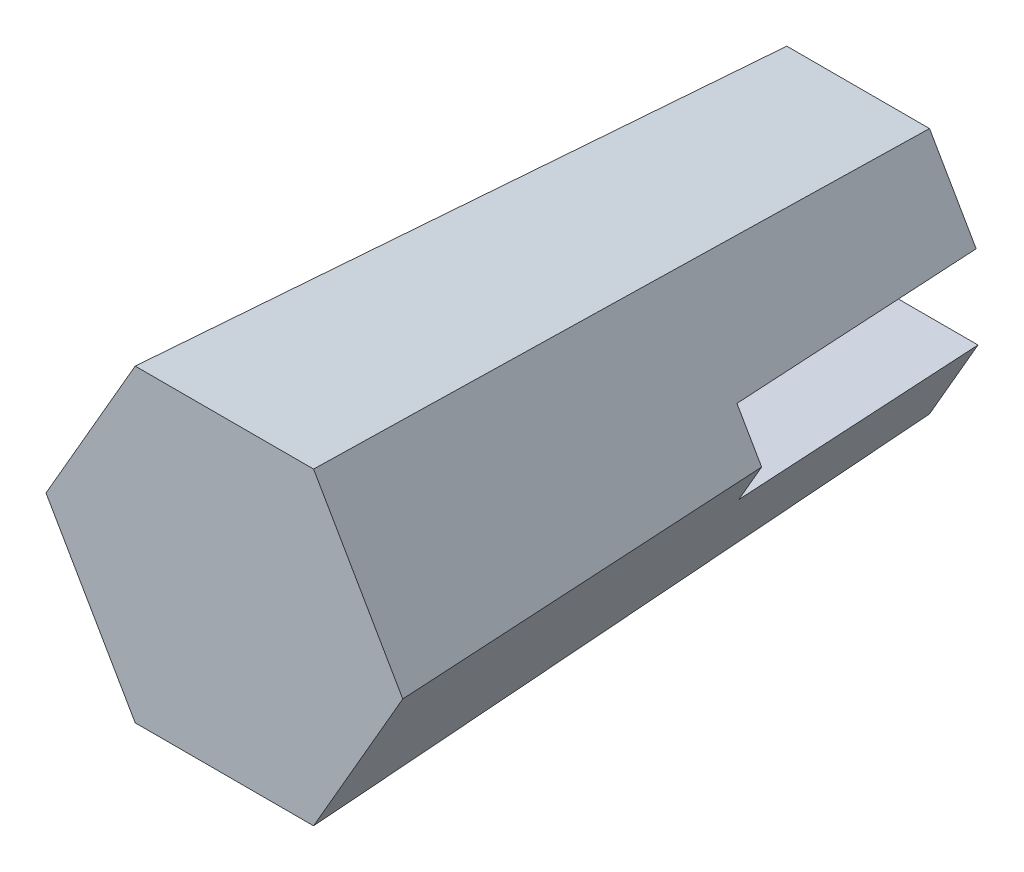
from build123d import *

# Parameters (mm, degrees)
CUT_EXTRUDE1_DEPTH = 20.32


with BuildPart() as part:
    # Sketch2 → Loft1 section 0
    with BuildSketch(Plane.XY.offset(50.8)):
        with BuildLine():
            Line((-14.298079416, 0), (-7.149039708, -12.3825))
            Line((-7.149039708, -12.3825), (7.149039708, -12.3825))
            Line((7.149039708, -12.3825), (14.298079416, 0))
            Line((14.298079416, 0), (7.149039708, 12.3825))
            Line((7.149039708, 12.3825), (-7.149039708, 12.3825))
            Line((-7.149039708, 12.3825), (-14.298079416, 0))
        make_face()
    # Sketch1 → Loft1 section 1
    with BuildSketch(Plane.XY):
        with BuildLine():
            Line((11.438463533, 0), (5.719231767, 9.906))
            Line((5.719231767, 9.906), (-5.719231767, 9.906))
            Line((-5.719231767, 9.906), (-11.438463533, 0))
            Line((-11.438463533, 0), (-5.719231767, -9.906))
            Line((-5.719231767, -9.906), (5.719231767, -9.906))
            Line((5.719231767, -9.906), (11.438463533, 0))
        make_face()
    loft()

    # Sketch4 → Cut-Extrude1 (cut)
    with BuildSketch(Plane(origin=(0, 0, 0), x_dir=(-1, 0, 0), z_dir=(0, 0, -1))):
        Polygon((-9.45872946, 3.429), (9.45872946, 3.429), (15.693203295, 3.429), (15.693203295, -3.175), (9.605376429, -3.175), (-9.605376429, -3.175), (-15.693203295, -3.175), (-15.693203295, 3.429), align=None)
    extrude(amount=-CUT_EXTRUDE1_DEPTH, mode=Mode.SUBTRACT)


solid = part.part
